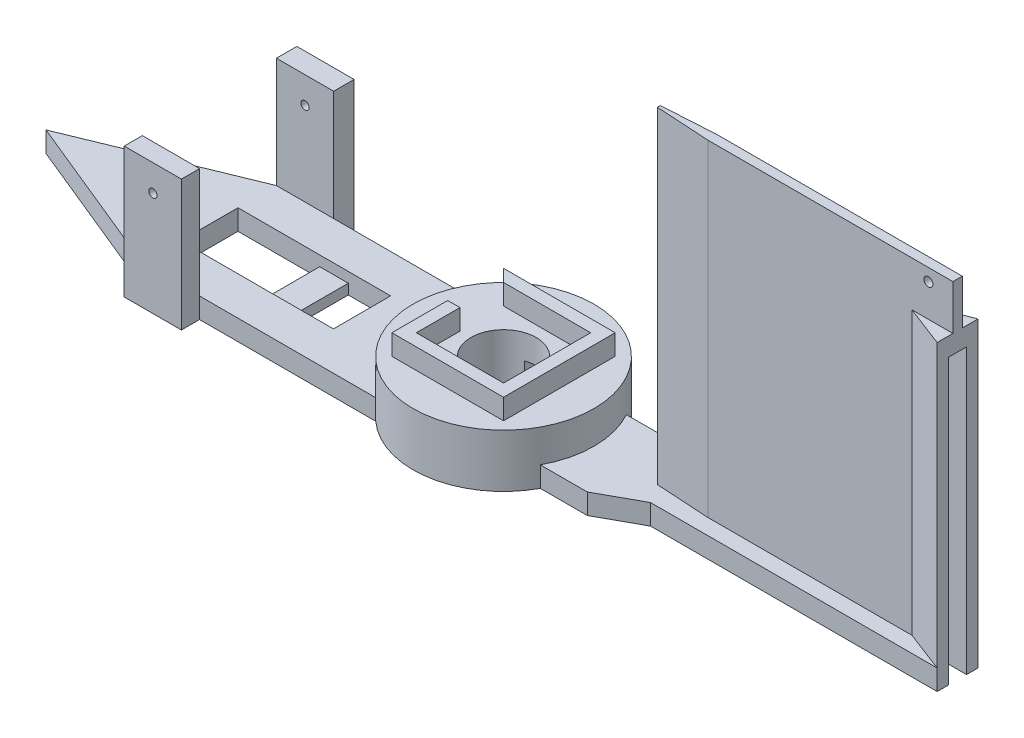
from build123d import *

# Parameters (mm, degrees)
SKETCH1_R                 = 22.15
SKETCH1_R_2               = 16.15
BOSS_EXTRUDE1_DEPTH       = 10
SKETCH2_R                 = 22.15
SKETCH2_R_2               = 12.15
BOSS_EXTRUDE2_DEPTH       = 3
BOSS_EXTRUDE3_START       = -13
BOSS_EXTRUDE3_DEPTH       = 5
SKETCH10_W                = 7
SKETCH10_H                = 4.438143107
SKETCH10_H_2              = 5
BOSS_EXTRUDE5_DEPTH       = 27
SKETCH11_R                = 1
CUT_EXTRUDE2_DEPTH        = 90.759903691
SKETCH12_W                = 14
SKETCH12_H                = 42.258143107
BOSS_EXTRUDE6_DEPTH       = 5
BOSS_EXTRUDE7_DEPTH       = 5
BOSS_EXTRUDE8_DEPTH       = 80
SKETCH16_W                = 26.34
SKETCH16_H                = 26.34
SKETCH16_W_2              = 21.34
SKETCH16_H_2              = 21.34
BOSS_EXTRUDE9_DEPTH       = 6
SKETCH17_W                = 2.5
SKETCH17_H                = 10.67
CUT_EXTRUDE3_DEPTH        = 6
BOSS_EXTRUDE11_DEPTH      = 5
BOSS_EXTRUDE12_START      = -2
SKETCH23_R                = 12.15
SKETCH23_R_2              = 8
BOSS_EXTRUDE12_DEPTH      = 1
SKETCH24_W                = 37.364360225
SKETCH24_H                = 7
CUT_EXTRUDE5_DEPTH        = 10
SKETCH25_R                = 1.1
CUT_EXTRUDE6_DEPTH        = 10
CUT_EXTRUDE8_DEPTH        = 80
SKETCH29_R                = 20.553911634
SKETCH29_R_2              = 17.753911634
CUT_EXTRUDE9_DEPTH        = 2.5
BOSS_EXTRUDE13_REACH      = 136.976
SKETCH30_W                = 7
SKETCH30_H                = 3
SKETCH31_W                = 3
SKETCH31_H                = 14
CUT_EXTRUDE10_DEPTH       = 135.976377563
CUT_EXTRUDE11_DEPTH       = 140.4081149
SKETCH36_W                = 26.34
SKETCH36_H                = 26.34
CUT_EXTRUDE12_DEPTH       = 6
SKETCH37_W                = 3
SKETCH37_H                = 4.4
CUT_EXTRUDE13_DEPTH       = 2.5
BOSS_EXTRUDE15_DEPTH      = 69
SKETCH41_W                = 4.4
SKETCH41_H                = 67
CUT_EXTRUDE14_DEPTH       = 5
BOSS_EXTRUDE16_REACH      = 175.826
BOSS_EXTRUDE16_END_RADIUS = 22.15
SKETCH42_W                = 5.67
SKETCH42_H                = 5
SKETCH42_W_2              = 5.5
SKETCH43_W                = 7
SKETCH43_H                = 2.5
BOSS_EXTRUDE17_DEPTH      = 14
CUT_EXTRUDE15_DEPTH       = 8
CUT_EXTRUDE16_DEPTH       = 140.4081149
BOSS_EXTRUDE18_START      = 2
SKETCH48_R                = 12.15
SKETCH48_R_2              = 8
BOSS_EXTRUDE18_DEPTH      = 2
BOSS_EXTRUDE19_START      = 10
SKETCH49_R                = 16.15
SKETCH49_R_2              = 8
BOSS_EXTRUDE19_DEPTH      = 10
SKETCH50_R                = 17.753911634
SKETCH50_R_2              = 14.5
CUT_EXTRUDE17_DEPTH       = 2.5
CUT_EXTRUDE18_DEPTH       = 7
BOSS_EXTRUDE20_DEPTH      = 5
CUT_EXTRUDE20_DEPTH       = 2.5


with BuildPart() as part:
    # Sketch1 → Boss-Extrude1 (new body)
    with BuildSketch(Plane(origin=(0, 0, 0), x_dir=(1, 0, 0), z_dir=(0, 1, 0))):
        with Locations(Location((0, 0, 0), (0, 0, 270))):
            Circle(SKETCH1_R)
        with Locations(Location((0, 0, 0), (0, 0, 270))):
            Circle(SKETCH1_R_2, mode=Mode.SUBTRACT)
    extrude(amount=BOSS_EXTRUDE1_DEPTH)

    # Sketch2 → Boss-Extrude2 (add)
    with BuildSketch(Plane(origin=(0, 10, 0), x_dir=(1, 0, 0), z_dir=(0, 1, 0))):
        with Locations(Location((0, 0, 0), (0, 0, 270))):
            Circle(SKETCH2_R)
        with Locations(Location((0, 0, 0), (0, 0, 270))):
            Circle(SKETCH2_R_2, mode=Mode.SUBTRACT)
    extrude(amount=BOSS_EXTRUDE2_DEPTH)

    # Sketch3 → Boss-Extrude3 (add)
    with BuildSketch(Plane(origin=(0, 13, 0), x_dir=(1, 0, 0), z_dir=(0, 1, 0)).offset(BOSS_EXTRUDE3_START)):
        with BuildLine():
            Line((-65, 0), (-22.15, 0))
            ThreePointArc((-22.15, 0), (-20.25036977, 8.974687972), (-14.877311585, 16.41))
            Line((-14.877311585, 16.41), (-65, 16.41))
            Line((-65, 16.41), (-65, 0))
        make_face()
        with BuildLine():
            ThreePointArc((-14.877311585, -16.41), (-20.25036977, -8.974687972), (-22.15, 0))
            Line((-22.15, 0), (-65, 0))
            Line((-65, 0), (-65, -16.41))
            Line((-65, -16.41), (-14.877311585, -16.41))
        make_face()
    extrude(amount=BOSS_EXTRUDE3_DEPTH)



with BuildPart() as body_2:
    # Sketch10 → Boss-Extrude5 (new body)
    with BuildSketch(Plane(origin=(0, 5, 0), x_dir=(1, 0, 0), z_dir=(0, 1, 0))):
        with Locations((-68.5, -18.629071554)):
            Rectangle(SKETCH10_W, SKETCH10_H)
        with Locations((-61.5, -18.629071554)):
            Rectangle(SKETCH10_W, SKETCH10_H)
        with Locations((-68.5, 18.91)):
            Rectangle(SKETCH10_W, SKETCH10_H_2)
        with Locations((-61.5, 18.91)):
            Rectangle(SKETCH10_W, SKETCH10_H_2)
    extrude(amount=BOSS_EXTRUDE5_DEPTH)

    # Sketch11 → Cut-Extrude2 (cut, through all)
    with BuildSketch(Plane.XY.offset(20.848143107)):
        with Locations((-65, 25.5)):
            Circle(SKETCH11_R)
    extrude(amount=-CUT_EXTRUDE2_DEPTH, mode=Mode.SUBTRACT)


with BuildPart() as part_1:
    add(part.part)

    add(body_2.part)  # Boss-Extrude6 merges body 2
    # Sketch12 → Boss-Extrude6 (add)
    with BuildSketch(Plane.XZ):
        with Locations((-65, -0.280928446)):
            Rectangle(SKETCH12_W, SKETCH12_H)
    extrude(amount=-BOSS_EXTRUDE6_DEPTH)

    # Sketch13 → Boss-Extrude7 (add)
    with BuildSketch(Plane.XZ):
        with BuildLine():
            Line((111.15, 0), (22.15, 0))
            ThreePointArc((22.15, 0), (22.006607786, -2.516289677), (21.578287699, -5))
            Line((21.578287699, -5), (111.15, -5))
            Line((111.15, -5), (111.15, 0))
        make_face()
        with BuildLine():
            ThreePointArc((21.578287699, 5), (22.006607786, 2.516289677), (22.15, 0))
            Line((22.15, 0), (111.15, 0))
            Line((111.15, 0), (111.15, 5))
            Line((111.15, 5), (21.578287699, 5))
        make_face()
    extrude(amount=-BOSS_EXTRUDE7_DEPTH)

    # Sketch14 → Boss-Extrude8 (add)
    with BuildSketch(Plane(origin=(0, 5, 0), x_dir=(1, 0, 0), z_dir=(0, 1, 0))):
        Polygon((111.15, -1.15), (111.15, 0), (111.15, 1.15), (51.15, 1.15), (32.15, 0), (51.15, -1.15), align=None)
    extrude(amount=BOSS_EXTRUDE8_DEPTH)

    # Sketch16 → Boss-Extrude9 (add)
    with BuildSketch(Plane(origin=(0, 13, 0), x_dir=(1, 0, 0), z_dir=(0, 1, 0))):
        with Locations((0.03, 0.03)):
            Rectangle(SKETCH16_W, SKETCH16_H)
        with Locations((0.03, 0.03)):
            Rectangle(SKETCH16_W_2, SKETCH16_H_2, mode=Mode.SUBTRACT)
    extrude(amount=BOSS_EXTRUDE9_DEPTH)

    # Sketch17 → Cut-Extrude3 (cut)
    with BuildSketch(Plane(origin=(0, 19, 0), x_dir=(1, 0, 0), z_dir=(0, 1, 0))):
        with Locations((-11.89, 5.365)):
            Rectangle(SKETCH17_W, SKETCH17_H)
    extrude(amount=-CUT_EXTRUDE3_DEPTH, mode=Mode.SUBTRACT)

    # Sketch20 → Boss-Extrude11 (add)
    with BuildSketch(Plane(origin=(0, 5, 0), x_dir=(1, 0, 0), z_dir=(0, 1, 0))):
        Polygon((-112, 0), (-72, 0), (-72, 16.41), align=None)
        Polygon((-72, -16.41), (-72, 0), (-112, 0), align=None)
    extrude(amount=-BOSS_EXTRUDE11_DEPTH)

    # Sketch23 → Boss-Extrude12 (add)
    with BuildSketch(Plane.XZ.offset(-10).offset(BOSS_EXTRUDE12_START)):
        with Locations(Location((0, 0, 0), (0, 0, 270))):
            Circle(SKETCH23_R)
        with Locations(Location((0, 0, 0), (0, 0, 270))):
            Circle(SKETCH23_R_2, mode=Mode.SUBTRACT)
    extrude(amount=-BOSS_EXTRUDE12_DEPTH)

    # Sketch24 → Cut-Extrude5 (cut)
    with BuildSketch(Plane(origin=(0, 5, 0), x_dir=(1, 0, 0), z_dir=(0, 1, 0))):
        with Locations((-53.317819888, 3.5)):
            Rectangle(SKETCH24_W, SKETCH24_H)
        with Locations((-53.317819888, -3.5)):
            Rectangle(SKETCH24_W, SKETCH24_H)
    extrude(amount=-CUT_EXTRUDE5_DEPTH, mode=Mode.SUBTRACT)

    # Sketch25 → Cut-Extrude6 (cut)
    with BuildSketch(Plane.XY.offset(1.15)):
        with Locations((105.15, 81.95)):
            Circle(SKETCH25_R)
    extrude(amount=-CUT_EXTRUDE6_DEPTH, mode=Mode.SUBTRACT)

    # Sketch28 → Cut-Extrude8 (cut)
    with BuildSketch(Plane(origin=(0, 85, 0), x_dir=(1, 0, 0), z_dir=(0, 1, 0))):
        Polygon((36.15, 0.242105263), (32.15, 0), (36.15, 0), align=None)
        Polygon((36.15, 0), (32.15, 0), (36.15, -0.242105263), align=None)
    extrude(amount=-CUT_EXTRUDE8_DEPTH, mode=Mode.SUBTRACT)

    # Sketch29 → Cut-Extrude9 (cut)
    # profile 1 of 4: a face of its own
    with BuildSketch(Plane.XZ):
        with BuildLine():
            Line((111.15, -2.2), (111.15, 0))
            Line((111.15, 0), (111.15, 2.2))
            Line((111.15, 2.2), (20.435833319, 2.2))
            ThreePointArc((20.435833319, 2.2), (20.524370827, 1.101583234), (20.553911634, 0))
            ThreePointArc((20.553911634, 0), (20.524370827, -1.101583234), (20.435833319, -2.2))
            Line((20.435833319, -2.2), (111.15, -2.2))
        make_face()
    # profile 2 of 4: a face of its own
    with BuildSketch(Plane.XZ):
        Circle(SKETCH29_R)
        with Locations(Location((0, 0, 0), (0, 0, 270))):
            Circle(SKETCH29_R_2, mode=Mode.SUBTRACT)
    # profile 3 of 4: a face of its own
    with BuildSketch(Plane.XZ):
        with BuildLine():
            Line((-34.635639775, -2.2), (-20.435833319, -2.2))
            ThreePointArc((-20.435833319, -2.2), (-20.524370827, -1.101583234), (-20.553911634, 0))
            Line((-20.553911634, 0), (-34.635639775, 0))
            Line((-34.635639775, 0), (-34.635639775, -2.2))
        make_face()
    # profile 4 of 4: a face of its own
    with BuildSketch(Plane.XZ):
        with BuildLine():
            ThreePointArc((-20.553911634, 0), (-20.524370827, 1.101583234), (-20.435833319, 2.2))
            Line((-20.435833319, 2.2), (-34.635639775, 2.2))
            Line((-34.635639775, 2.2), (-34.635639775, 0))
            Line((-34.635639775, 0), (-20.553911634, 0))
        make_face()
    extrude(amount=-CUT_EXTRUDE9_DEPTH, mode=Mode.SUBTRACT)

    # Boss-Extrude13: up to this face of the body (flat: up to its plane)
    boss_extrude13_end = Plane(part_1.part.faces().sort_by_distance((0, 0, 17.251755182))[0])
    # Sketch30 → Boss-Extrude13 (add, up to the picked face)
    with BuildSketch(Plane(origin=(0, 13, 0), x_dir=(1, 0, 0), z_dir=(0, 1, 0)), mode=Mode.PRIVATE) as boss_extrude13_sk1:
        Polygon((-38.34, -10.5), (-38.34, 0), (-38.34, 10.67), (-31.34, 10.67), (-31.34, 13.67), (-41.34, 13.67), (-41.34, -13.5), (-38.34, -13.5), align=None)
    boss_extrude13_tool1 = split(extrude(boss_extrude13_sk1.sketch, amount=-BOSS_EXTRUDE13_REACH, mode=Mode.PRIVATE), bisect_by=boss_extrude13_end, keep=Keep.BOTH, mode=Mode.PRIVATE)
    # Sketch30 → Boss-Extrude13 (add, up to the picked face)
    with BuildSketch(Plane(origin=(0, 13, 0), x_dir=(1, 0, 0), z_dir=(0, 1, 0)), mode=Mode.PRIVATE) as boss_extrude13_sk2:
        with Locations((-34.84, -12)):
            Rectangle(SKETCH30_W, SKETCH30_H)
    boss_extrude13_tool2 = split(extrude(boss_extrude13_sk2.sketch, amount=-BOSS_EXTRUDE13_REACH, mode=Mode.PRIVATE), bisect_by=boss_extrude13_end, keep=Keep.BOTH, mode=Mode.PRIVATE)
    # Sketch30 → Boss-Extrude13 (add, up to the picked face)
    with BuildSketch(Plane(origin=(0, 13, 0), x_dir=(1, 0, 0), z_dir=(0, 1, 0)), mode=Mode.PRIVATE) as boss_extrude13_sk3:
        Polygon((38, -10.5), (31, -10.5), (31, -13.5), (41, -13.5), (41, 13.67), (38, 13.67), (38, 10.67), align=None)
    boss_extrude13_tool3 = split(extrude(boss_extrude13_sk3.sketch, amount=-BOSS_EXTRUDE13_REACH, mode=Mode.PRIVATE), bisect_by=boss_extrude13_end, keep=Keep.BOTH, mode=Mode.PRIVATE)
    # Sketch30 → Boss-Extrude13 (add, up to the picked face)
    with BuildSketch(Plane(origin=(0, 13, 0), x_dir=(1, 0, 0), z_dir=(0, 1, 0)), mode=Mode.PRIVATE) as boss_extrude13_sk4:
        with Locations((34.5, 12.17)):
            Rectangle(SKETCH30_W, SKETCH30_H)
    boss_extrude13_tool4 = split(extrude(boss_extrude13_sk4.sketch, amount=-BOSS_EXTRUDE13_REACH, mode=Mode.PRIVATE), bisect_by=boss_extrude13_end, keep=Keep.BOTH, mode=Mode.PRIVATE)
    add(boss_extrude13_tool1.solids().sort_by(Axis((-38.81571, 13, -2.56071), (0, -1, 0)))[0])
    add(boss_extrude13_tool2.solids().sort_by(Axis((-34.84, 13, 12), (0, -1, 0)))[0])
    add(boss_extrude13_tool3.solids().sort_by(Axis((38.47571, 13, 2.39071), (0, -1, 0)))[0])
    add(boss_extrude13_tool4.solids().sort_by(Axis((34.5, 13, -12.17), (0, -1, 0)))[0])

    # Sketch31 → Cut-Extrude10 (cut, through all)
    with BuildSketch(Plane(origin=(0, 13, 0), x_dir=(1, 0, 0), z_dir=(0, 1, 0))):
        with Locations((-39.84, 0)):
            Rectangle(SKETCH31_W, SKETCH31_H)
    extrude(amount=-CUT_EXTRUDE10_DEPTH, mode=Mode.SUBTRACT)

    # Sketch33 → Cut-Extrude11 (cut, through all)
    with BuildSketch(Plane(origin=(0, 5, 0), x_dir=(1, 0, 0), z_dir=(0, 1, 0))):
        Polygon((38, 0.354078947), (36.15, 0.242105263), (36.15, -0.242105263), (38, -0.354078947), align=None)
    extrude(amount=CUT_EXTRUDE11_DEPTH, mode=Mode.SUBTRACT)

    # Sketch36 → Cut-Extrude12 (cut)
    with BuildSketch(Plane(origin=(0, 19, 0), x_dir=(1, 0, 0), z_dir=(0, 1, 0))):
        with Locations((0.03, 0.03)):
            Rectangle(SKETCH36_W, SKETCH36_H)
    extrude(amount=-CUT_EXTRUDE12_DEPTH, mode=Mode.SUBTRACT)

    # Sketch37 → Cut-Extrude13 (cut)
    with BuildSketch(Plane.XZ):
        with Locations((39.5, 0)):
            Rectangle(SKETCH37_W, SKETCH37_H)
    extrude(amount=-CUT_EXTRUDE13_DEPTH, mode=Mode.SUBTRACT)

    # Sketch40 → Boss-Extrude15 (add)
    with BuildSketch(Plane(origin=(0, 5, 0), x_dir=(1, 0, 0), z_dir=(0, 1, 0))):
        Polygon((101.15, -1.15), (111.15, -5), (111.15, -1.15), align=None)
        Polygon((101.15, 1.15), (111.15, 5), (111.15, 1.15), align=None)
    extrude(amount=BOSS_EXTRUDE15_DEPTH)

    # Sketch41 → Cut-Extrude14 (cut)
    with BuildSketch(Plane(origin=(111.15, 0, 0), x_dir=(0, 0, -1), z_dir=(1, 0, 0))):
        with Locations((0, 36)):
            Rectangle(SKETCH41_W, SKETCH41_H)
    extrude(amount=-CUT_EXTRUDE14_DEPTH, mode=Mode.SUBTRACT)

    # Boss-Extrude16: up to this cylinder (the profile starts outside it)
    boss_extrude16_end = Plane(origin=(0, 2.5, 0), z_dir=(0, -1, 0)) * Cylinder(BOSS_EXTRUDE16_END_RADIUS, 396.952, mode=Mode.PRIVATE)
    # Sketch42 → Boss-Extrude16 (add, up to the surface)
    with BuildSketch(Plane.ZY.offset(-38), mode=Mode.PRIVATE) as boss_extrude16_sk1:
        with Locations((-7.835, 2.5)):
            Rectangle(SKETCH42_W, SKETCH42_H)
    boss_extrude16_tool1 = extrude(boss_extrude16_sk1.sketch, amount=BOSS_EXTRUDE16_REACH, mode=Mode.PRIVATE) - boss_extrude16_end
    add(boss_extrude16_tool1.solids().sort_by_distance((38, 2.5, -7.835))[0])
    # Sketch42 → Boss-Extrude16 (add, up to the surface)
    with BuildSketch(Plane.ZY.offset(-38), mode=Mode.PRIVATE) as boss_extrude16_sk2:
        with Locations((7.75, 2.5)):
            Rectangle(SKETCH42_W_2, SKETCH42_H)
    boss_extrude16_tool2 = extrude(boss_extrude16_sk2.sketch, amount=BOSS_EXTRUDE16_REACH, mode=Mode.PRIVATE) - boss_extrude16_end
    add(boss_extrude16_tool2.solids().sort_by_distance((38, 2.5, 7.75))[0])

    # Sketch43 → Boss-Extrude17 (add)
    with BuildSketch(Plane.XY.offset(-7)):
        with Locations((-48.5, 1.25)):
            Rectangle(SKETCH43_W, SKETCH43_H)
    extrude(amount=BOSS_EXTRUDE17_DEPTH)

    # Sketch44 → Cut-Extrude15 (cut)
    with BuildSketch(Plane(origin=(0, 13, 0), x_dir=(1, 0, 0), z_dir=(0, 1, 0))):
        Polygon((41, -13.5), (41, -0.535657895), (38, -0.354078947), (38, 0.354078947), (41, 0.535657895), (41, 13.67), (31, 13.67), (31, -13.5), align=None)
        Polygon((-41.34, 13.67), (-41.34, 7), (-38.34, 7), (-38.34, 10.67), (-31.34, 10.67), (-31.34, 13.67), align=None)
        Polygon((-38.34, 7), (-41.34, 7), (-41.34, -13.5), (-31.34, -13.5), (-31.34, 10.67), (-38.34, 10.67), align=None)
    extrude(amount=-CUT_EXTRUDE15_DEPTH, mode=Mode.SUBTRACT)

    # Sketch45 → Cut-Extrude16 (cut, through all)
    with BuildSketch(Plane(origin=(0, 5, 0), x_dir=(1, 0, 0), z_dir=(0, 1, 0))):
        Polygon((31, -10.5), (41, -5), (41, -13.5), (31, -13.5), align=None)
        Polygon((41, 13.67), (31, 13.67), (31, 10.67), (41, 5), align=None)
    extrude(amount=-CUT_EXTRUDE16_DEPTH, mode=Mode.SUBTRACT)

    # Sketch48 → Boss-Extrude18 (add)
    with BuildSketch(Plane(origin=(0, 12, 0), x_dir=(-1, 0, 0), z_dir=(0, -1, 0)).offset(BOSS_EXTRUDE18_START)):
        Circle(SKETCH48_R)
        with Locations(Location((0, 0, 0), (0, 0, 270))):
            Circle(SKETCH48_R_2, mode=Mode.SUBTRACT)
    extrude(amount=-BOSS_EXTRUDE18_DEPTH)

    # Sketch49 → Boss-Extrude19 (add)
    with BuildSketch(Plane.XZ.offset(-10).offset(BOSS_EXTRUDE19_START)):
        Circle(SKETCH49_R)
        with Locations(Location((0, 0, 0), (0, 0, 90))):
            Circle(SKETCH49_R_2, mode=Mode.SUBTRACT)
    extrude(amount=-BOSS_EXTRUDE19_DEPTH)

    # Sketch50 → Cut-Extrude17 (cut)
    with BuildSketch(Plane(origin=(0, 0, 0), x_dir=(-1, 0, 0), z_dir=(0, -1, 0))):
        Circle(SKETCH50_R)
        with Locations(Location((0, 0, 0), (0, 0, 90))):
            Circle(SKETCH50_R_2, mode=Mode.SUBTRACT)
    extrude(amount=-CUT_EXTRUDE17_DEPTH, mode=Mode.SUBTRACT)

    # Sketch51 → Cut-Extrude18 (cut)
    with BuildSketch(Plane.XZ):
        with BuildLine():
            ThreePointArc((-2.5, 7.599342077), (-1.265950905, 7.899200485), (0, 8))
            ThreePointArc((0, 8), (1.265950905, 7.899200485), (2.5, 7.599342077))
            Line((2.5, 7.599342077), (2.5, 10.5))
            Line((2.5, 10.5), (-2.5, 10.5))
            Line((-2.5, 10.5), (-2.5, 7.599342077))
        make_face()
        with BuildLine():
            ThreePointArc((0, -8), (-1.265950905, -7.899200485), (-2.5, -7.599342077))
            Line((-2.5, -7.599342077), (-2.5, -10.5))
            Line((-2.5, -10.5), (2.5, -10.5))
            Line((2.5, -10.5), (2.5, -7.599342077))
            ThreePointArc((2.5, -7.599342077), (1.265950905, -7.899200485), (0, -8))
        make_face()
    extrude(amount=-CUT_EXTRUDE18_DEPTH, mode=Mode.SUBTRACT)

    # Sketch52 → Boss-Extrude20 (add)
    with BuildSketch(Plane(origin=(0, 13, 0), x_dir=(1, 0, 0), z_dir=(0, 1, 0))):
        Polygon((-10.67, -10.67), (-10.67, 0), (-13.67, 0), (-13.67, -13.67), (13.67, -13.67), (13.67, 13.67), (-13.67, 13.67), (-10.67, 10.67), (10.67, 10.67), (10.67, -10.67), align=None)
    extrude(amount=BOSS_EXTRUDE20_DEPTH)

    # Sketch53 → Cut-Extrude20 (cut)
    with BuildSketch(Plane.XZ):
        with BuildLine():
            Line((-7.691553809, 2.2), (-14.332131733, 2.2))
            ThreePointArc((-14.332131733, 2.2), (-14.5, 0), (-14.332131733, -2.2))
            Line((-14.332131733, -2.2), (-7.691553809, -2.2))
            ThreePointArc((-7.691553809, -2.2), (-8, 0), (-7.691553809, 2.2))
        make_face()
    extrude(amount=-CUT_EXTRUDE20_DEPTH, mode=Mode.SUBTRACT)


solid = part_1.part
